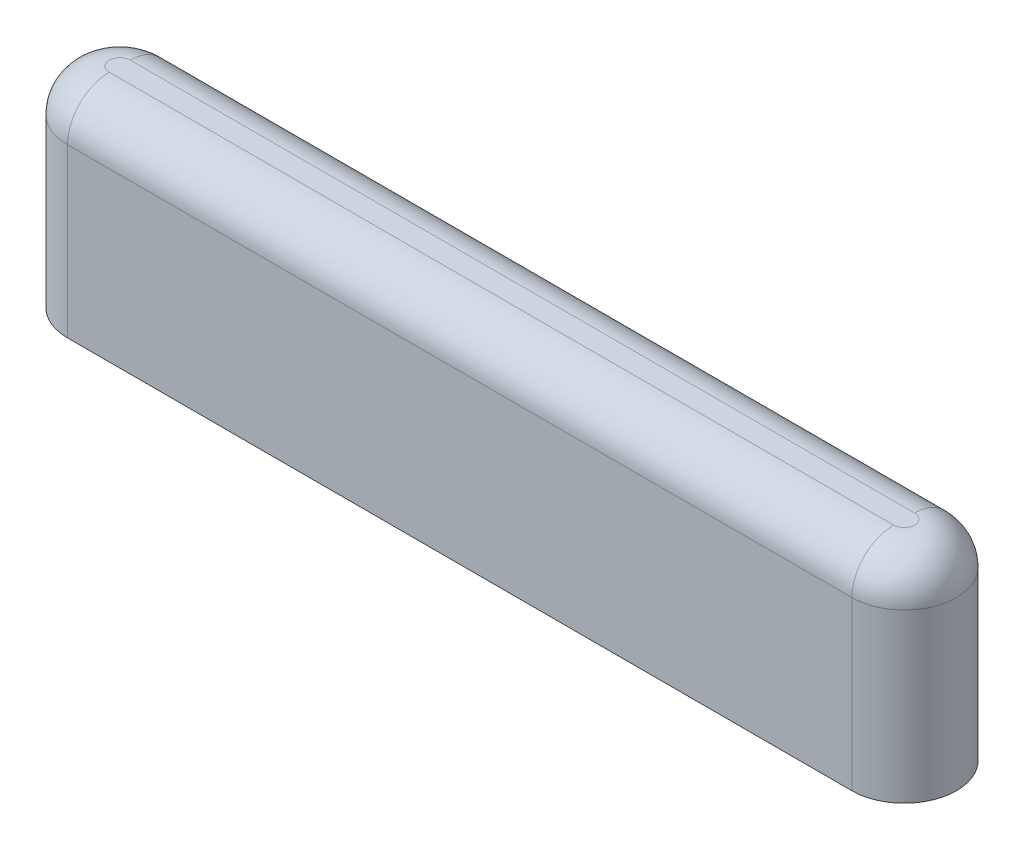
from build123d import *

# Parameters (mm, degrees)
BOSS_EXTRUDE1_DEPTH = 20
FILLET1_R           = 4
SKETCH2_R           = 2.75
CUT_EXTRUDE1_DEPTH  = 1.5
LPATTERN1_COUNT     = 3
LPATTERN1_PITCH     = 30


with BuildPart() as part:
    # Sketch1 → Boss-Extrude1 (new body)
    with BuildSketch(Plane(origin=(0, 0, 0), x_dir=(1, 0, 0), z_dir=(0, 1, 0))):
        with BuildLine():
            Line((37.5, -5), (-37.5, -5))
            ThreePointArc((-37.5, -5), (-42.5, 0), (-37.5, 5))
            Line((-37.5, 5), (37.5, 5))
            ThreePointArc((37.5, 5), (42.5, 0), (37.5, -5))
        make_face()
    extrude(amount=BOSS_EXTRUDE1_DEPTH)

    # Fillet1
    fillet1_edges = [part.edges().sort_by_distance(p)[0] for p in [
        (-42.5, 20, 0),
        (0, 20, 5),
        (42.5, 20, 0),
        (0, 20, -5),
    ]]
    fillet(fillet1_edges, radius=FILLET1_R)

    # Sketch2 → Cut-Extrude1 (cut)
    with BuildSketch(Plane.XZ):
        with Locations(Location((-37.5, 0, 0), (0, 0, 270))):
            Circle(SKETCH2_R)
    cut_extrude1 = extrude(amount=-CUT_EXTRUDE1_DEPTH, mode=Mode.SUBTRACT)

    # LPattern1: Cut-Extrude1 ×3
    with Locations(*[(i * LPATTERN1_PITCH, 0, 0) for i in range(1, LPATTERN1_COUNT)]):
        add(cut_extrude1, mode=Mode.SUBTRACT)


solid = part.part
